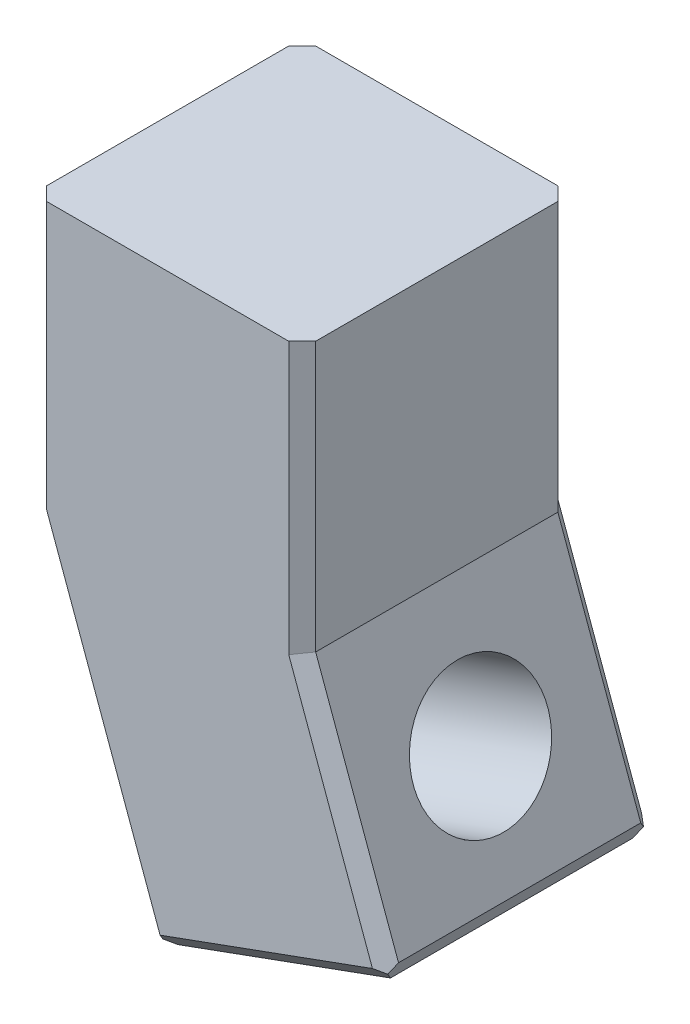
from build123d import *

# Parameters (mm, degrees)
EXTRUDE_1_DEPTH     = 20
SKETCH_2_R          = 5
CUT_EXTRUDE_1_DEPTH = 20
CHAMFER_1_SIZE      = 1
CHAMFER_2_SIZE      = 1


with BuildPart() as part:
    # 草图1 → 凸台-拉伸1 (new body)
    with BuildSketch(Plane.XY):
        Polygon((10, -10), (16.500534984, -27.860073083), (-1.159909447, -34.28794918), (-10, -10), (-10, 10), (10, 10), align=None)
    extrude(amount=EXTRUDE_1_DEPTH)

    # 草图2 → 切除-拉伸1 (cut)
    with BuildSketch(Plane(origin=(5.616284167, 2.044160264, 0), x_dir=(0, 0, -1), z_dir=(0.9396926207859104, 0.34202014332566316, 0))):
        with Locations(Location((-10, -22.320274036, 0), (0, 0, 90))):
            Circle(SKETCH_2_R)
    extrude(amount=-CUT_EXTRUDE_1_DEPTH, mode=Mode.SUBTRACT)

    # 倒角1
    chamfer_1_edges = [part.edges().sort_by_distance(p)[0] for p in [
        (16.500534984, -27.860073083, 10),
        (-1.159909447, -34.28794918, 10),
        (7.670312768, -31.074011132, 20),
        (7.670312768, -31.074011132, 0),
    ]]
    chamfer(chamfer_1_edges, length=CHAMFER_1_SIZE)

    # 倒角2
    chamfer_2_edges = [part.edges().sort_by_distance(p)[0] for p in [
        (-10, 0, 20),
        (-5.750964795, -21.67412828, 20),
        (13.07925742, -18.460190231, 20),
        (13.07925742, -18.460190231, 0),
        (10, 0, 20),
        (-5.750964795, -21.67412828, 0),
        (-10, 0, 0),
        (10, 0, 0),
    ]]
    chamfer(chamfer_2_edges, length=CHAMFER_2_SIZE)


solid = part.part
